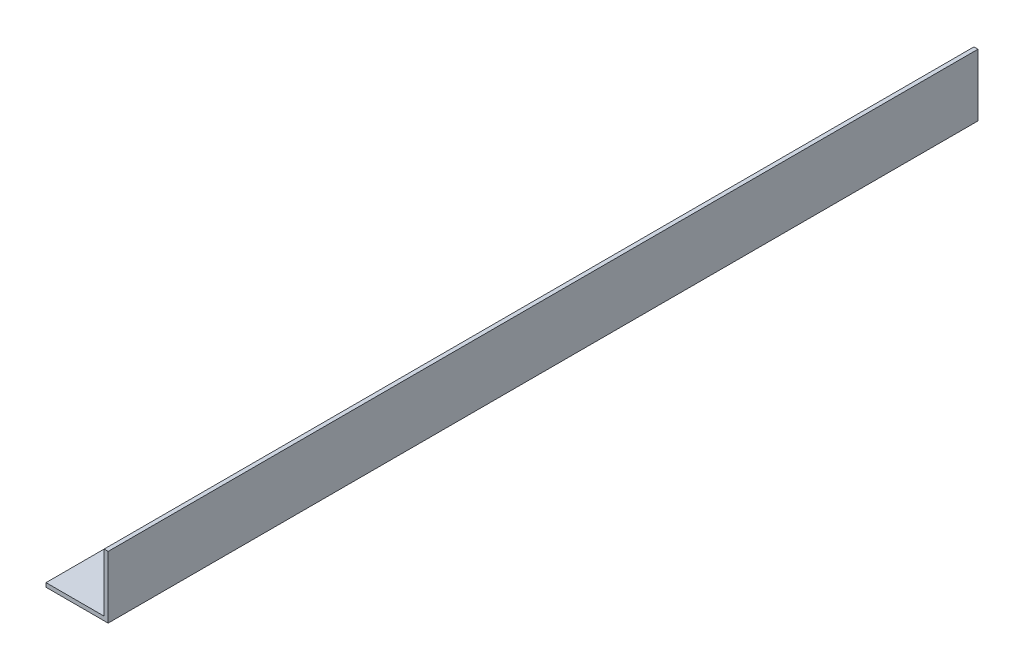
from build123d import *

# Parameters (mm, degrees)
SKETCH1_W           = 25.4
SKETCH1_H           = 25.4
BOSS_EXTRUDE1_DEPTH = 355.6
SKETCH3_W           = 26.173809645
SKETCH3_H           = 26.478044322
CUT_EXTRUDE2_DEPTH  = 355.6
SKETCH4_R           = 3.556
CUT_EXTRUDE3_DEPTH  = 360.694820013


with BuildPart() as part:
    # Sketch1 → Boss-Extrude1 (new body)
    with BuildSketch(Plane.XY):
        with Locations((-35.089575682, -12.7)):
            Rectangle(SKETCH1_W, SKETCH1_H)
    extrude(amount=BOSS_EXTRUDE1_DEPTH)

    # Sketch3 → Cut-Extrude2 (cut)
    with BuildSketch(Plane.XY.offset(355.6)):
        with Locations((-37.127480504, -10.509977839)):
            Rectangle(SKETCH3_W, SKETCH3_H)
    extrude(amount=-CUT_EXTRUDE2_DEPTH, mode=Mode.SUBTRACT)

    # Sketch4 → Cut-Extrude3 (cut, through all)
    with BuildSketch(Plane.XZ.offset(25.4)):
        with Locations(Location((-34.94531992, 19.05, 0), (0, 0, 270))):
            Circle(SKETCH4_R)
    extrude(amount=-CUT_EXTRUDE3_DEPTH, mode=Mode.SUBTRACT)


solid = part.part
